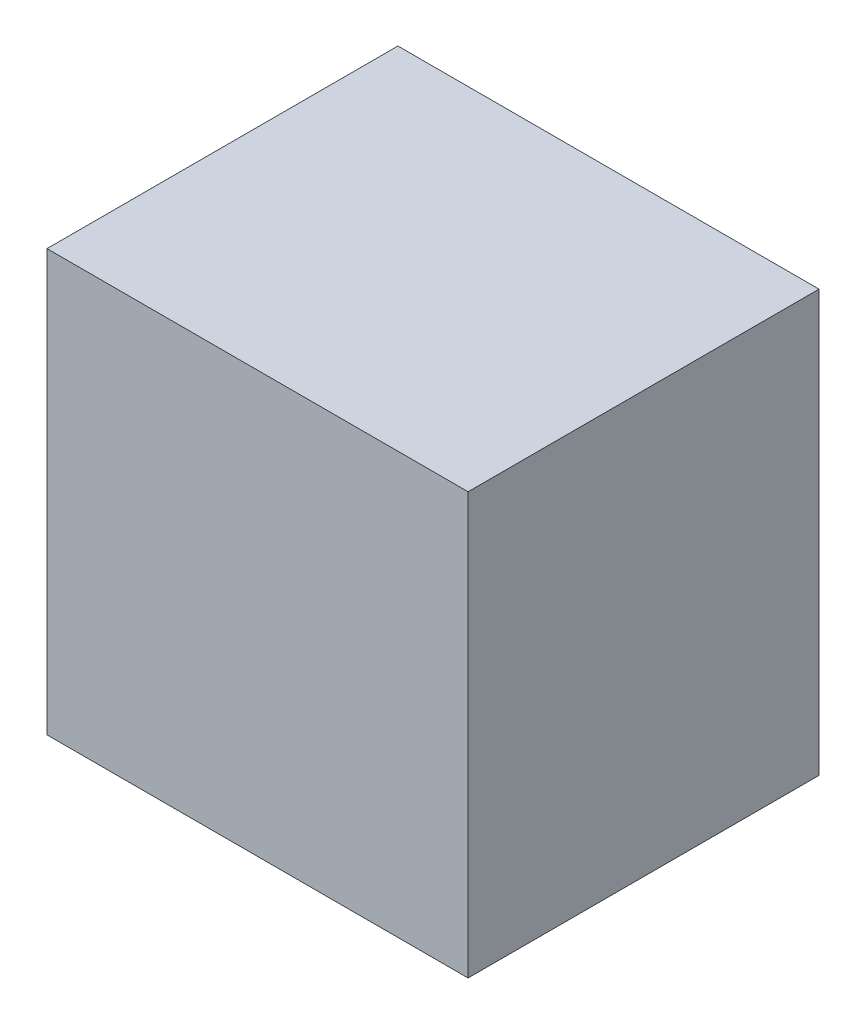
from build123d import *

# Parameters (mm, degrees)
SKETCH_1_W      = 60
SKETCH_1_H      = 60
EXTRUDE_1_DEPTH = 50


with BuildPart() as part:
    # 草图1 → 凸台-拉伸1 (new body)
    with BuildSketch(Plane.XY):
        Rectangle(SKETCH_1_W, SKETCH_1_H)
    extrude(amount=EXTRUDE_1_DEPTH)


solid = part.part
